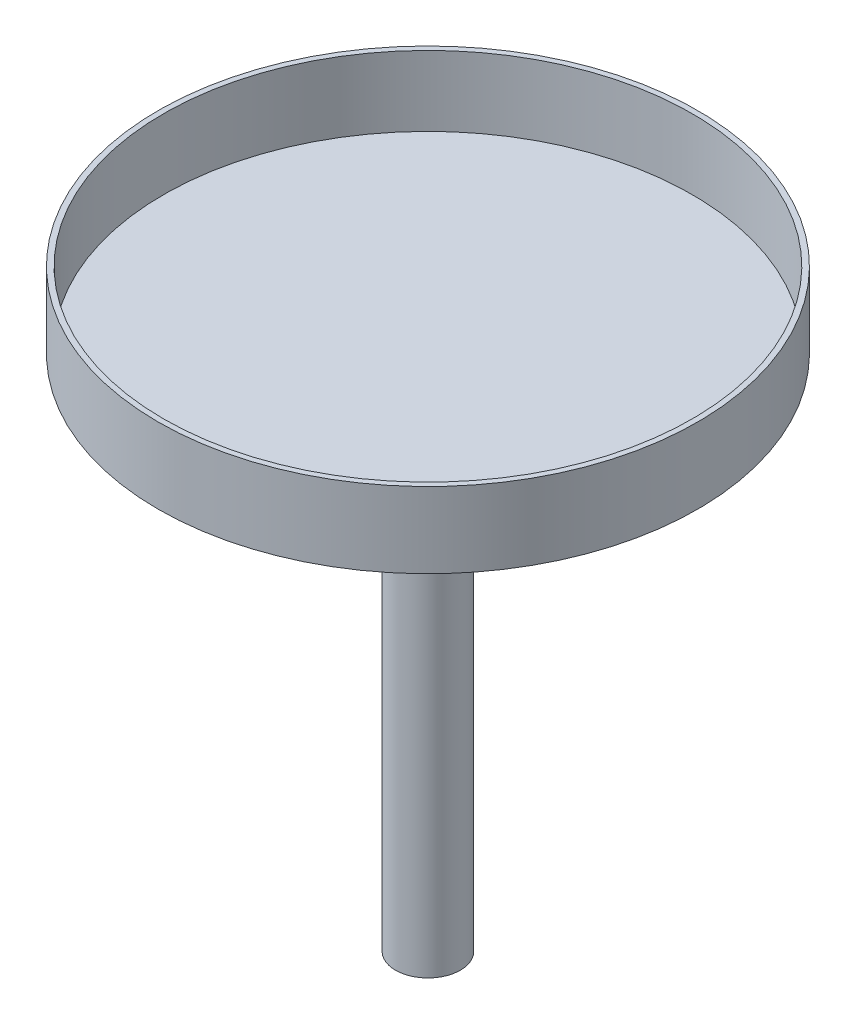
from build123d import *


with BuildPart() as part:
    # Sketch1 → Revolve1 (revolve)
    with BuildSketch(Plane.XY, mode=Mode.PRIVATE) as revolve1_sk:
        Polygon((30, -480), (30, 0), (250, 0), (250, 70), (245, 70), (245, 5), (0, 5), (0, -480), align=None)
    revolve(revolve1_sk.sketch.rotate(Axis((0, 40.928571429, 0), (0, -1, 0)), 90), axis=Axis((0, 40.928571429, 0), (0, -1, 0)))


solid = part.part
